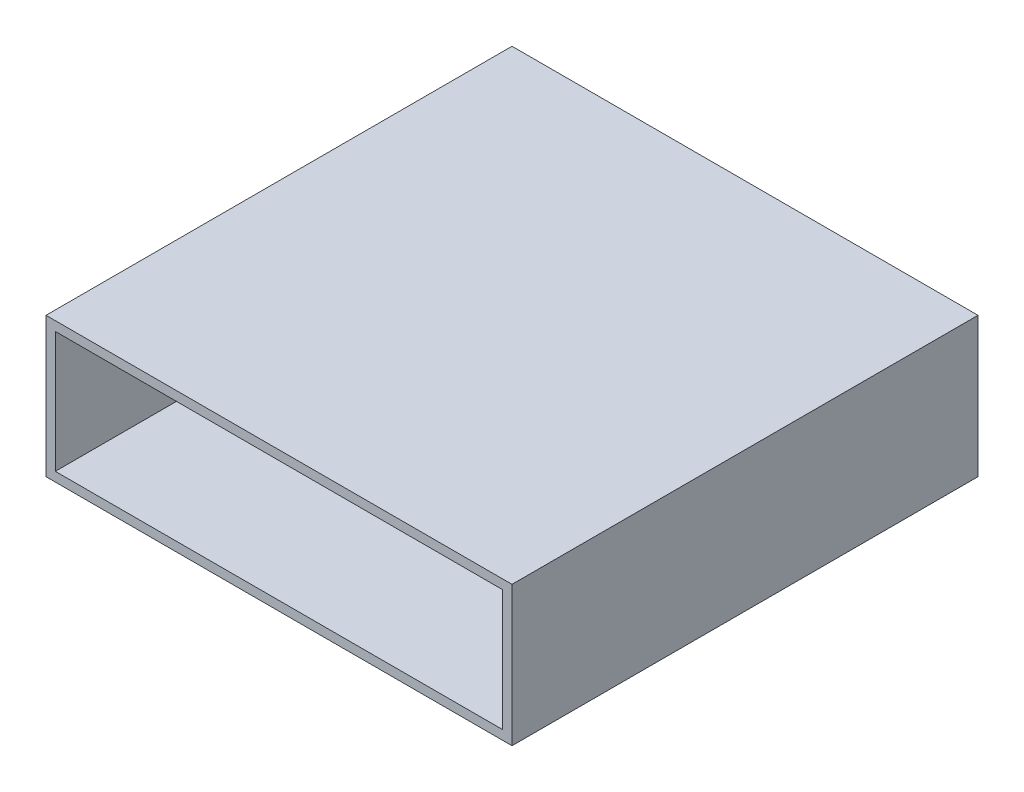
from build123d import *

# Parameters (mm, degrees)
SKETCH_1_W      = 50
SKETCH_1_H      = 15
SKETCH_1_W_2    = 48
SKETCH_1_H_2    = 13
EXTRUDE_1_DEPTH = 50


with BuildPart() as part:
    # 草图1 → 凸台-拉伸1 (new body)
    with BuildSketch(Plane.XY):
        with Locations((25, 7.5)):
            Rectangle(SKETCH_1_W, SKETCH_1_H)
        with Locations((25, 7.5)):
            Rectangle(SKETCH_1_W_2, SKETCH_1_H_2, mode=Mode.SUBTRACT)
    extrude(amount=EXTRUDE_1_DEPTH)


solid = part.part
